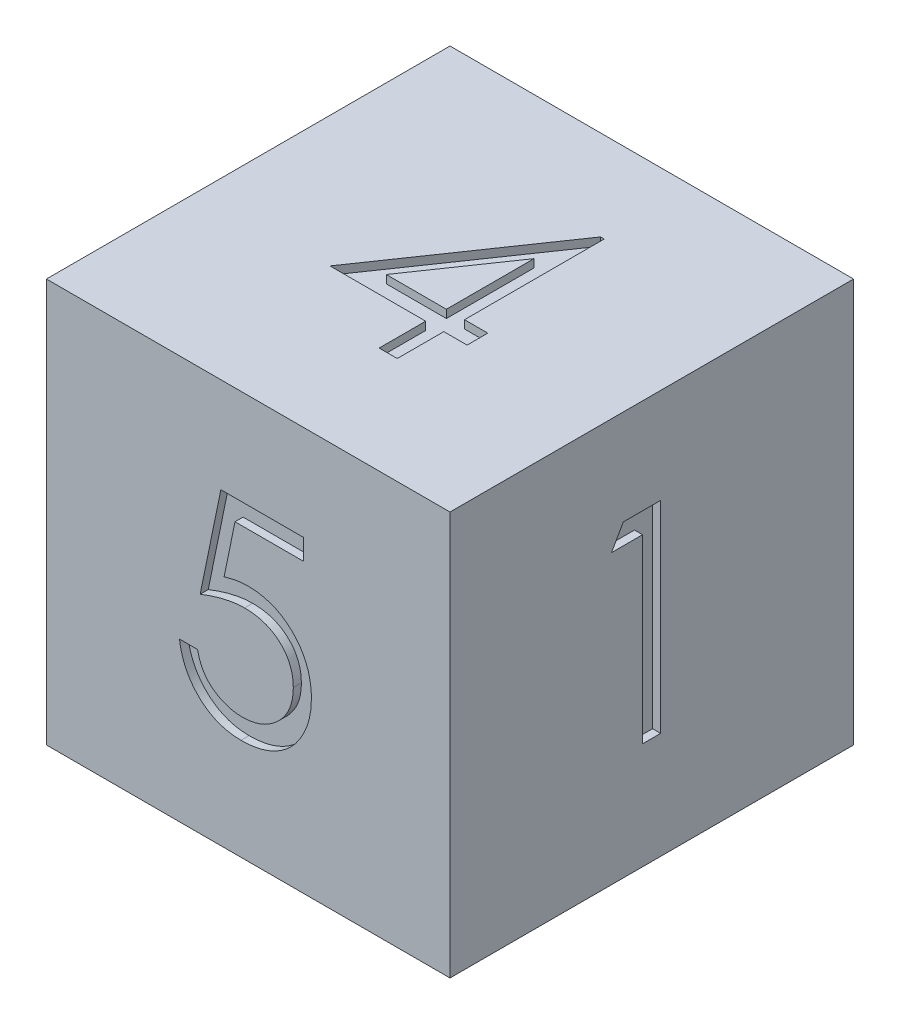
from build123d import *

# Parameters (mm, degrees)
BOSS_EXTRUDE1_DEPTH      = 25
BOSS_EXTRUDE1_DEPTH_BACK = 25
SKETCH1_W                = 50
SKETCH1_H                = 50
CUT_EXTRUDE1_DEPTH       = 1
CUT_EXTRUDE2_DEPTH       = 1
CUT_EXTRUDE3_DEPTH       = 1
CUT_EXTRUDE4_DEPTH       = 1
CUT_EXTRUDE5_DEPTH       = 1
CUT_EXTRUDE6_DEPTH       = 1


with BuildPart() as part:
    # Sketch1 → Boss-Extrude1 (new, two sides: drawn at the far end of the back side and taken through both)
    with BuildSketch(Plane.XY.offset(-BOSS_EXTRUDE1_DEPTH_BACK)):
        Rectangle(SKETCH1_W, SKETCH1_H)
    extrude(amount=BOSS_EXTRUDE1_DEPTH + BOSS_EXTRUDE1_DEPTH_BACK)

    # Sketch2 → Cut-Extrude1 (cut)
    with BuildSketch(Plane(origin=(25, 0, 0), x_dir=(0, 0, -1), z_dir=(1, 0, 0))):
        Polygon((-3.524959936, 13.2), (1.097435897, 13.2), (1.097435897, -11.8), (-1.146153846, -11.8), (-1.146153846, 10.635897436), (-4.992307692, 10.635897436), align=None)
    extrude(amount=-CUT_EXTRUDE1_DEPTH, mode=Mode.SUBTRACT)

    # Sketch3 → Cut-Extrude2 (cut)
    with BuildSketch(Plane.ZY.offset(25)):
        with BuildLine():
            Line((2.7, 13.841025641), (4.427764423, 12.483854167))
            Line((4.427764423, 12.483854167), (-2.177804487, 2.382692308))
            add(Edge.make_bspline(
                [(-2.177804487, 2.382692308), (-1.738016794, 2.452791312), (-0.880161175, 2.589527347), (-0.011833328, 2.6120841), (0.411338141, 2.623076923)],
                knots=[0, 0, 0, 0, 1.025318673, 2, 2, 2, 2], degree=3))
            add(Edge.make_bspline(
                [(0.411338141, 2.623076923), (0.665427401, 2.616247554), (1.165594547, 2.602804144), (1.899928848, 2.499348067), (2.605564105, 2.336311554), (3.279575621, 2.098652583), (3.924382634, 1.795064337), (4.543685464, 1.431215264), (5.125842679, 0.988317547), (5.678351102, 0.493567863), (6.179973226, -0.054410598), (6.624087908, -0.635848717), (6.997136421, -1.250140725), (7.299807289, -1.896975481), (7.534842137, -2.575355907), (7.706182458, -3.284414046), (7.807465264, -4.024638842), (7.821218769, -4.52805438), (7.828205128, -4.783774038)],
                knots=[0, 0, 0, 0, 1.04369286, 2.054478336, 3.041073146, 4.015093852, 4.984733326, 5.965804835, 6.960378782, 7.985147595, 9.009457201, 10.008161701, 10.986880575, 11.956520048, 12.937015923, 13.931873656, 14.949455224, 16, 16, 16, 16], degree=3))
            add(Edge.make_bspline(
                [(7.828205128, -4.783774038), (7.818040093, -5.133629067), (7.79803771, -5.822060966), (7.598724882, -6.824751726), (7.289013133, -7.77998398), (6.846316502, -8.672506633), (6.296442338, -9.501096415), (5.625888104, -10.235278311), (4.858434616, -10.890064292), (3.990671772, -11.437611572), (3.056793457, -11.884776222), (2.075707761, -12.205956523), (1.05694243, -12.40369559), (0.365480944, -12.428485609), (0.015705128, -12.441025641)],
                knots=[0, 0, 0, 0, 1.031375318, 2.029502543, 3.004789286, 3.987476834, 4.960371455, 5.9300674, 6.912260825, 7.929083631, 8.949397511, 9.960523116, 10.96833055, 12, 12, 12, 12], degree=3))
            add(Edge.make_bspline(
                [(0.015705128, -12.441025641), (-0.320699876, -12.430109886), (-0.987059291, -12.408487686), (-1.967293535, -12.215873844), (-2.909172231, -11.903680252), (-3.80609638, -11.473578263), (-4.636957901, -10.93030767), (-5.380283875, -10.276291391), (-6.032367979, -9.525509497), (-6.575043843, -8.678078446), (-7.005463357, -7.767435892), (-7.328248537, -6.817884775), (-7.516793131, -5.832884905), (-7.543139966, -5.165162483), (-7.556410256, -4.828846154)],
                knots=[0, 0, 0, 0, 1.012016664, 2.004627821, 2.994792927, 3.992885782, 4.990978636, 5.973936114, 6.964471063, 7.975201453, 8.993600317, 9.990122807, 10.98767138, 12, 12, 12, 12], degree=3))
            add(Edge.make_bspline(
                [(-7.556410256, -4.828846154), (-7.547971364, -4.571384845), (-7.530740757, -4.045698045), (-7.410430826, -3.249526417), (-7.217110863, -2.434875833), (-7.000609103, -1.74377445), (-6.771854746, -1.177620722), (-6.581479463, -0.721167218), (-6.344522348, -0.251445266), (-6.09185534, 0.247652134), (-5.800734848, 0.763262367), (-5.484194495, 1.304002863), (-5.133482703, 1.861273775), (-4.887624397, 2.239446599), (-4.761939103, 2.432772436)],
                knots=[0, 0, 0, 0, 1.173818275, 2.396712641, 3.66331629, 4.989737886, 5.693666774, 6.447286557, 7.243889047, 8.091586357, 8.998013824, 9.943181721, 10.948533338, 12, 12, 12, 12], degree=3))
            Line((-4.761939103, 2.432772436), (2.7, 13.841025641))
        make_face()
        with BuildLine():
            add(Edge.make_bspline(
                [(-0.059415064, 0.058974359), (-0.24985967, 0.053416904), (-0.621853309, 0.04256158), (-1.167620557, -0.020475933), (-1.684143781, -0.139183545), (-2.178266165, -0.29037163), (-2.640749757, -0.498250628), (-3.074955756, -0.750763478), (-3.482563269, -1.048057607), (-3.859302924, -1.385921258), (-4.200871948, -1.75583578), (-4.495022882, -2.152046652), (-4.748754312, -2.565005246), (-4.955053018, -2.998161976), (-5.115696416, -3.451351259), (-5.231898208, -3.922488754), (-5.29656786, -4.414733798), (-5.307326656, -4.748537389), (-5.312820513, -4.918990385)],
                knots=[0, 0, 0, 0, 1.129588631, 2.206414736, 3.251139165, 4.268635594, 5.265702196, 6.250456724, 7.242448911, 8.251968645, 9.246821453, 10.222880186, 11.173611482, 12.116736599, 13.062300278, 14.020270554, 14.989073742, 16, 16, 16, 16], degree=3))
            add(Edge.make_bspline(
                [(-5.312820513, -4.918990385), (-5.308346502, -5.087918812), (-5.299573634, -5.419162311), (-5.219914206, -5.907299307), (-5.098235046, -6.377048653), (-4.917232219, -6.825988645), (-4.701325875, -7.260962345), (-4.416287845, -7.666214384), (-4.10045366, -8.066357742), (-3.722925564, -8.430653966), (-3.317758686, -8.769629853), (-2.884892954, -9.065917378), (-2.433750383, -9.319390045), (-1.958240226, -9.518040743), (-1.465108912, -9.681071363), (-0.950247811, -9.795796215), (-0.413298843, -9.860657115), (-0.049570714, -9.871429926), (0.135897436, -9.876923077)],
                knots=[0, 0, 0, 0, 0.989467248, 1.94019797, 2.891935182, 3.827694429, 4.772920941, 5.730924762, 6.725747692, 7.756678648, 8.79901574, 9.819492441, 10.826891316, 11.826466727, 12.835195252, 13.867842842, 14.912794438, 16, 16, 16, 16], degree=3))
            add(Edge.make_bspline(
                [(0.135897436, -9.876923077), (0.321365282, -9.871429496), (0.685092815, -9.860655839), (1.222046103, -9.795801062), (1.736891236, -9.681053577), (2.230080583, -9.518105218), (2.705376519, -9.319150864), (3.15612453, -9.067494294), (3.584896627, -8.767807739), (3.99032948, -8.431233251), (4.366286183, -8.064284309), (4.689695318, -7.669786291), (4.966004127, -7.257687039), (5.190534034, -6.827702111), (5.369543258, -6.3767772), (5.491839452, -5.907372029), (5.571334373, -5.419143272), (5.580129846, -5.087912382), (5.584615385, -4.918990385)],
                knots=[0, 0, 0, 0, 1.087397944, 2.132534446, 3.165364764, 4.174271784, 5.174024072, 6.181601208, 7.194203697, 8.236725232, 9.267838612, 10.269026844, 11.221737037, 12.171628256, 13.107553087, 14.05945871, 15.010357665, 16, 16, 16, 16], degree=3))
            add(Edge.make_bspline(
                [(5.584615385, -4.918990385), (5.58068472, -4.748315021), (5.572970105, -4.413334789), (5.485713329, -3.922708944), (5.364696373, -3.448957471), (5.181960439, -2.995057835), (4.944556548, -2.562801212), (4.655389355, -2.150004063), (4.320870996, -1.753501582), (3.934459999, -1.385195808), (3.513815471, -1.048430965), (3.066561289, -0.75114842), (2.598647192, -0.500255729), (2.110547603, -0.290919284), (1.596669869, -0.139851612), (1.065310304, -0.020899876), (0.509672856, 0.042400251), (0.132697083, 0.053379288), (-0.059415064, 0.058974359)],
                knots=[0, 0, 0, 0, 0.978206639, 1.919901502, 2.851605144, 3.780102724, 4.718870031, 5.675451981, 6.667674623, 7.690630536, 8.733308323, 9.756129687, 10.767539656, 11.776269907, 12.797430371, 13.836405707, 14.897401972, 16, 16, 16, 16], degree=3))
        make_face(mode=Mode.SUBTRACT)
    extrude(amount=-CUT_EXTRUDE2_DEPTH, mode=Mode.SUBTRACT)

    # Sketch4 → Cut-Extrude3 (cut)
    with BuildSketch(Plane.XY.offset(25)):
        with BuildLine():
            Line((6.866666667, 13.2), (6.866666667, 10.635897436))
            Line((6.866666667, 10.635897436), (-1.636939103, 10.635897436))
            Line((-1.636939103, 10.635897436), (-2.984094551, 4.060376603))
            add(Edge.make_bspline(
                [(-2.984094551, 4.060376603), (-2.719409734, 4.133449973), (-2.206624764, 4.27501807), (-1.449768614, 4.432202144), (-0.731252875, 4.526955316), (-0.265000229, 4.539893248), (-0.039383013, 4.546153846)],
                knots=[0, 0, 0, 0, 1.100273476, 2.13160584, 3.095893838, 4, 4, 4, 4], degree=3))
            add(Edge.make_bspline(
                [(-0.039383013, 4.546153846), (0.239786557, 4.540111448), (0.78870368, 4.528230585), (1.591839016, 4.414145946), (2.358502539, 4.234575127), (3.087090897, 3.983714257), (3.778951973, 3.662930449), (4.42772027, 3.262216589), (5.043133934, 2.794121367), (5.614152462, 2.25594271), (6.132183235, 1.663645447), (6.587654589, 1.026803511), (6.974530234, 0.351605925), (7.285678484, -0.368398424), (7.534138014, -1.125249519), (7.699509406, -1.926910823), (7.809628756, -2.765825966), (7.821931515, -3.339430038), (7.828205128, -3.63193109)],
                knots=[0, 0, 0, 0, 1.052922333, 2.070308379, 3.05430497, 4.020497103, 4.973039431, 5.925935799, 6.892292201, 7.88610001, 8.88166317, 9.857072816, 10.836096531, 11.812156883, 12.81219415, 13.836441305, 14.89672472, 16, 16, 16, 16], degree=3))
            add(Edge.make_bspline(
                [(7.828205128, -3.63193109), (7.823454591, -3.835661235), (7.814017715, -4.240368289), (7.766027803, -4.841398294), (7.673629831, -5.429704245), (7.549574659, -6.005364186), (7.388557388, -6.567288273), (7.193635574, -7.117084901), (6.95509252, -7.651332092), (6.69343984, -8.175084914), (6.39882214, -8.676502823), (6.071832802, -9.145424155), (5.726365007, -9.588883308), (5.354640825, -10.002124259), (4.953205146, -10.382431529), (4.526919668, -10.732062111), (4.079185961, -11.056928756), (3.603077087, -11.343844436), (3.109202209, -11.607865552), (2.590429229, -11.824462247), (2.058567083, -12.018108876), (1.505960829, -12.172462645), (0.933862167, -12.293409463), (0.341328057, -12.37555661), (-0.268533872, -12.435388306), (-0.681926819, -12.439133713), (-0.890745192, -12.441025641)],
                knots=[0, 0, 0, 0, 1.056347294, 2.098418968, 3.122841568, 4.141288669, 5.149314143, 6.15115421, 7.162517403, 8.180376062, 9.185164535, 10.17417709, 11.141909838, 12.097768115, 13.052685741, 14.0056014, 14.954263652, 15.917497458, 16.885230207, 17.854509472, 18.828990115, 19.81800267, 20.826176721, 21.857883937, 22.917946725, 24, 24, 24, 24], degree=3))
            add(Edge.make_bspline(
                [(-0.890745192, -12.441025641), (-1.139846483, -12.436091084), (-1.629923845, -12.426382926), (-2.347927896, -12.324822317), (-3.038746508, -12.179365771), (-3.696818659, -11.960535272), (-4.328041971, -11.68634031), (-4.923918527, -11.339796228), (-5.49967407, -10.947088344), (-6.031902904, -10.483657252), (-6.525875143, -9.977116666), (-6.968064492, -9.427419229), (-7.361875754, -8.8436375), (-7.701002519, -8.222936399), (-7.990274099, -7.566946892), (-8.217524016, -6.873211172), (-8.400940837, -6.145354001), (-8.478536697, -5.644257498), (-8.517948718, -5.38974359)],
                knots=[0, 0, 0, 0, 1.0467383, 2.05933395, 3.04377827, 4.011590433, 4.970194871, 5.932262533, 6.905835911, 7.896367577, 8.894135286, 9.877477877, 10.858688626, 11.851381753, 12.8477658, 13.868841284, 14.917554742, 16, 16, 16, 16], degree=3))
            Line((-8.517948718, -5.38974359), (-6.274358974, -5.38974359))
            add(Edge.make_bspline(
                [(-6.274358974, -5.38974359), (-6.219154993, -5.628146822), (-6.113049876, -6.086371071), (-5.88015167, -6.730166366), (-5.595395417, -7.303875106), (-5.256792928, -7.815086415), (-4.852864139, -8.260864967), (-4.391939647, -8.658129696), (-3.875170195, -9.016523476), (-3.300932841, -9.315257528), (-2.695125132, -9.570034338), (-2.061073632, -9.739689302), (-1.416042586, -9.858981394), (-0.979768513, -9.870922542), (-0.760536859, -9.876923077)],
                knots=[0, 0, 0, 0, 1.136247022, 2.183929868, 3.172523383, 4.106158343, 5.02341133, 5.958108904, 6.928429099, 7.938127109, 8.96079061, 9.975095812, 10.982467395, 12, 12, 12, 12], degree=3))
            add(Edge.make_bspline(
                [(-0.760536859, -9.876923077), (-0.54654797, -9.871060378), (-0.125202098, -9.859516675), (0.494879236, -9.770666588), (1.093542623, -9.633826793), (1.664880886, -9.429042115), (2.218891883, -9.180151269), (2.741561672, -8.86075787), (3.248010794, -8.49318631), (3.722497462, -8.072067524), (4.157064957, -7.607998277), (4.541037251, -7.111731181), (4.860872346, -6.582325134), (5.130401695, -6.028945471), (5.335068116, -5.445527205), (5.481075124, -4.834804525), (5.566811259, -4.195268952), (5.578605401, -3.759059597), (5.584615385, -3.536778846)],
                knots=[0, 0, 0, 0, 1.027316725, 2.022795036, 3.002884548, 3.971462791, 4.93288096, 5.914575861, 6.907176829, 7.935150275, 8.956128384, 9.956726525, 10.942570165, 11.921478529, 12.907843606, 13.90538589, 14.932640048, 16, 16, 16, 16], degree=3))
            add(Edge.make_bspline(
                [(5.584615385, -3.536778846), (5.57991196, -3.336237763), (5.570705675, -2.943707127), (5.495487316, -2.369427081), (5.364651799, -1.826048207), (5.183052657, -1.310946536), (4.952484744, -0.823636234), (4.670725371, -0.363614375), (4.332486814, 0.063055862), (3.946116181, 0.456574102), (3.52284446, 0.81975178), (3.055389156, 1.129352397), (2.553532536, 1.389808952), (2.023321111, 1.614580369), (1.452143264, 1.776014264), (0.851310176, 1.897213446), (0.21433369, 1.96732318), (-0.221171225, 1.977050954), (-0.445032051, 1.982051282)],
                knots=[0, 0, 0, 0, 1.045622112, 2.046656509, 3.013763289, 3.955457236, 4.890082067, 5.820317437, 6.762574623, 7.722996705, 8.69280354, 9.665887285, 10.63943826, 11.638615906, 12.663482002, 13.728887084, 14.832589034, 16, 16, 16, 16], degree=3))
            add(Edge.make_bspline(
                [(-0.445032051, 1.982051282), (-0.638810114, 1.977904202), (-1.038912652, 1.969341535), (-1.652647129, 1.906295129), (-2.297588007, 1.804585883), (-2.971262976, 1.664684115), (-3.675695176, 1.481604996), (-4.409398039, 1.262215706), (-5.173914229, 0.999915715), (-5.689040831, 0.801828474), (-5.953846154, 0.7)],
                knots=[0, 0, 0, 0, 0.817624296, 1.688186739, 2.600797293, 3.572016777, 4.590301741, 5.671205678, 6.80286297, 8, 8, 8, 8], degree=3))
            Line((-5.953846154, 0.7), (-3.38974359, 13.2))
            Line((-3.38974359, 13.2), (6.866666667, 13.2))
        make_face()
    extrude(amount=-CUT_EXTRUDE3_DEPTH, mode=Mode.SUBTRACT)

    # Sketch5 → Cut-Extrude4 (cut)
    with BuildSketch(Plane(origin=(0, 0, -25), x_dir=(-1, 0, 0), z_dir=(0, 0, -1))):
        with BuildLine():
            Line((-5.633333333, 5.507692308), (-7.876923077, 5.507692308))
            add(Edge.make_bspline(
                [(-7.876923077, 5.507692308), (-7.862300555, 5.805341506), (-7.833582312, 6.38991661), (-7.699094532, 7.242230227), (-7.506659695, 8.056907361), (-7.23457788, 8.827406747), (-6.896675896, 9.560541084), (-6.491461415, 10.253398339), (-6.01150534, 10.903335401), (-5.467171525, 11.504327139), (-4.875966961, 12.05566693), (-4.238067393, 12.531775808), (-3.56774577, 12.934044889), (-2.867035777, 13.270339473), (-2.128031751, 13.522766944), (-1.35743991, 13.71006437), (-0.55187465, 13.822752553), (-0.003017349, 13.834865308), (0.276121795, 13.841025641)],
                knots=[0, 0, 0, 0, 1.10065271, 2.161652631, 3.183658789, 4.190468796, 5.17591951, 6.163126047, 7.15150782, 8.156236427, 9.156009102, 10.134482811, 11.092018607, 12.041330605, 13.001268258, 13.972401359, 14.968799086, 16, 16, 16, 16], degree=3))
            add(Edge.make_bspline(
                [(0.276121795, 13.841025641), (0.550250895, 13.834608095), (1.088904786, 13.821997846), (1.875062032, 13.71370478), (2.623471278, 13.544093411), (3.33266961, 13.306126152), (3.996998643, 12.986237385), (4.621448961, 12.601969252), (5.213454753, 12.157541885), (5.74636035, 11.63430036), (6.235703773, 11.075711899), (6.657862738, 10.479369731), (7.019385335, 9.863446261), (7.320725905, 9.223244822), (7.542555469, 8.552737476), (7.710971241, 7.861686027), (7.806167053, 7.142937377), (7.820777221, 6.65646198), (7.828205128, 6.409134615)],
                knots=[0, 0, 0, 0, 1.111607364, 2.184268762, 3.212621178, 4.221274766, 5.211760367, 6.196651075, 7.1921475, 8.207485113, 9.220403448, 10.201281604, 11.166441695, 12.114753415, 13.065576456, 14.026450734, 14.996634279, 16, 16, 16, 16], degree=3))
            add(Edge.make_bspline(
                [(7.828205128, 6.409134615), (7.816110394, 6.060935797), (7.79213317, 5.370648556), (7.58703048, 4.35625668), (7.266698258, 3.373446543), (6.881002852, 2.582465814), (6.491913966, 1.945083716), (6.141288911, 1.420307252), (5.730825975, 0.855268192), (5.25455099, 0.25185864), (4.722316189, -0.394647825), (4.129300736, -1.08386065), (3.471275865, -1.808659005), (3.009429431, -2.303699015), (2.770112179, -2.560216346)],
                knots=[0, 0, 0, 0, 1.184426356, 2.348067706, 3.509069118, 4.696110526, 5.333549288, 6.050745305, 6.844228056, 7.710549037, 8.667450064, 9.695053472, 10.805634456, 12, 12, 12, 12], degree=3))
            Line((2.770112179, -2.560216346), (-3.484895833, -9.235897436))
            Line((-3.484895833, -9.235897436), (8.148717949, -9.235897436))
            Line((8.148717949, -9.235897436), (8.148717949, -11.8))
            Line((8.148717949, -11.8), (-8.838461538, -11.8))
            Line((-8.838461538, -11.8), (0.857051282, -1.453445513))
            add(Edge.make_bspline(
                [(0.857051282, -1.453445513), (1.093107616, -1.207029037), (1.546523524, -0.733713419), (2.187827644, -0.042692275), (2.763820418, 0.598375873), (3.278230366, 1.188279791), (3.719898262, 1.735648132), (4.111842776, 2.222753158), (4.425882711, 2.670999231), (4.766706966, 3.190575045), (5.096806833, 3.824948739), (5.380466519, 4.600189377), (5.553429723, 5.398241181), (5.574178548, 5.937541446), (5.584615385, 6.208814103)],
                knots=[0, 0, 0, 0, 1.329631726, 2.553950428, 3.673215718, 4.687767853, 5.603093632, 6.413772471, 7.123043292, 7.734684054, 8.834405432, 9.900288307, 10.943827018, 12, 12, 12, 12], degree=3))
            add(Edge.make_bspline(
                [(5.584615385, 6.208814103), (5.580074368, 6.37939552), (5.571124897, 6.715578737), (5.492141343, 7.208477015), (5.372780585, 7.683939971), (5.201743028, 8.143430108), (4.975980599, 8.582327622), (4.701170742, 9.001166767), (4.384098861, 9.406087947), (4.01730408, 9.785754362), (3.614364653, 10.133477258), (3.188691441, 10.441506439), (2.738333554, 10.698928659), (2.265189824, 10.909953639), (1.770579328, 11.075492076), (1.253545434, 11.190196215), (0.715516747, 11.262213958), (0.348134635, 11.271958043), (0.1609375, 11.276923077)],
                knots=[0, 0, 0, 0, 0.991446411, 1.95395049, 2.89581595, 3.838931463, 4.798493298, 5.75982156, 6.748411868, 7.785213223, 8.824556874, 9.840280684, 10.836137867, 11.835679398, 12.848801643, 13.863922112, 14.911575587, 16, 16, 16, 16], degree=3))
            add(Edge.make_bspline(
                [(0.1609375, 11.276923077), (-0.034568448, 11.271815704), (-0.41850985, 11.261785666), (-0.982217228, 11.19162378), (-1.519972782, 11.070582063), (-2.033129231, 10.905034389), (-2.522554844, 10.694616183), (-2.985869445, 10.432532292), (-3.422032939, 10.119793056), (-3.831865249, 9.765217653), (-4.209465099, 9.370449073), (-4.541228498, 8.930377908), (-4.831114314, 8.453039227), (-5.08403741, 7.939721009), (-5.289435196, 7.385765437), (-5.446386271, 6.793138974), (-5.570578033, 6.164414821), (-5.612067466, 5.730235644), (-5.633333333, 5.507692308)],
                knots=[0, 0, 0, 0, 1.031018746, 2.02475058, 2.990194455, 3.934040569, 4.864654155, 5.795059489, 6.735614925, 7.690564532, 8.649604399, 9.611025574, 10.590972636, 11.591080095, 12.624614302, 13.701020113, 14.821632451, 16, 16, 16, 16], degree=3))
        make_face()
    extrude(amount=-CUT_EXTRUDE4_DEPTH, mode=Mode.SUBTRACT)

    # Sketch6 → Cut-Extrude5 (cut)
    with BuildSketch(Plane(origin=(0, 25, 0), x_dir=(1, 0, 0), z_dir=(0, 1, 0))):
        Polygon((4.808373397, 13.841025641), (5.264102564, 13.841025641), (5.264102564, -3.466666667), (8.148717949, -3.466666667), (8.148717949, -6.030769231), (5.264102564, -6.030769231), (5.264102564, -11.8), (3.020512821, -11.8), (3.020512821, -6.030769231), (-8.838461538, -6.030769231), align=None)
        Polygon((3.020512821, -3.466666667), (3.020512821, 7.390705128), (-4.431410256, -3.466666667), align=None, mode=Mode.SUBTRACT)
    extrude(amount=-CUT_EXTRUDE5_DEPTH, mode=Mode.SUBTRACT)

    # Sketch7 → Cut-Extrude6 (cut)
    with BuildSketch(Plane.XZ.offset(25)):
        with BuildLine():
            Line((-5.633333333, 7.430769231), (-7.876923077, 7.430769231))
            add(Edge.make_bspline(
                [(-7.876923077, 7.430769231), (-7.816140572, 7.682429831), (-7.697315747, 8.174405719), (-7.449475936, 8.877314725), (-7.179481256, 9.542482735), (-6.855273366, 10.15745469), (-6.501639408, 10.73458971), (-6.096477111, 11.260797741), (-5.658479093, 11.749461781), (-5.174015169, 12.183127763), (-4.6659533, 12.575825829), (-4.127134588, 12.910647667), (-3.568399633, 13.19867733), (-2.985877255, 13.435964701), (-2.377833171, 13.614718441), (-1.749764433, 13.74440991), (-1.100025147, 13.828632154), (-0.658970928, 13.836851891), (-0.435016026, 13.841025641)],
                knots=[0, 0, 0, 0, 1.162005537, 2.271625781, 3.343758855, 4.383309926, 5.390229558, 6.379919256, 7.361854164, 8.333198761, 9.295911338, 10.242430842, 11.177959212, 12.116337295, 13.062827104, 14.020064771, 14.994644689, 16, 16, 16, 16], degree=3))
            add(Edge.make_bspline(
                [(-0.435016026, 13.841025641), (-0.108710725, 13.831173996), (0.53678221, 13.8116856), (1.485089688, 13.63372534), (2.399566968, 13.352117251), (3.270204452, 12.9630192), (4.078907542, 12.483109821), (4.798451733, 11.911933129), (5.419083953, 11.260509546), (5.939758079, 10.54099123), (6.347436644, 9.772023306), (6.648053597, 8.980593612), (6.831065605, 8.16857953), (6.854783867, 7.620313251), (6.866666667, 7.345633013)],
                knots=[0, 0, 0, 0, 1.083050992, 2.142477498, 3.193116406, 4.255571735, 5.30263384, 6.308962982, 7.297363603, 8.282367274, 9.249857812, 10.179914175, 11.08814088, 12, 12, 12, 12], degree=3))
            add(Edge.make_bspline(
                [(6.866666667, 7.345633013), (6.858355302, 7.081298765), (6.842091251, 6.564037662), (6.703993354, 5.808884111), (6.471591477, 5.097158394), (6.149664601, 4.425864379), (5.732939242, 3.79925838), (5.228134264, 3.215930589), (4.63168668, 2.673293745), (4.179694266, 2.362440366), (3.946995192, 2.202403846)],
                knots=[0, 0, 0, 0, 1.024540389, 2.004866551, 2.965041327, 3.920577974, 4.882998113, 5.874504559, 6.905732034, 8, 8, 8, 8], degree=3))
            add(Edge.make_bspline(
                [(3.946995192, 2.202403846), (4.212936296, 2.073988335), (4.739842541, 1.819560066), (5.458060609, 1.32059037), (6.110045433, 0.744473603), (6.473643426, 0.294883225), (6.656330128, 0.068990385)],
                knots=[0, 0, 0, 0, 1.015518401, 2.012035669, 3.001164323, 4, 4, 4, 4], degree=3))
            add(Edge.make_bspline(
                [(6.656330128, 0.068990385), (6.776625431, -0.095707841), (7.015246117, -0.422407245), (7.309785644, -0.94766743), (7.576993603, -1.478749496), (7.785209455, -2.029888111), (7.946451361, -2.594695352), (8.061708734, -3.174141038), (8.133309741, -3.768698341), (8.143563684, -4.170930342), (8.148717949, -4.373116987)],
                knots=[0, 0, 0, 0, 1.025084078, 2.033381695, 3.024893161, 4.013698104, 4.991890475, 5.976764909, 6.982997093, 8, 8, 8, 8], degree=3))
            add(Edge.make_bspline(
                [(8.148717949, -4.373116987), (8.135899995, -4.723186424), (8.110324409, -5.421677866), (7.881723878, -6.453640163), (7.527343588, -7.462393751), (7.024079759, -8.427214031), (6.410740411, -9.329931039), (5.681045238, -10.13761896), (4.843285178, -10.831894705), (3.908959115, -11.411967763), (2.896693911, -11.875667207), (1.814011111, -12.197506085), (0.676510726, -12.407120368), (-0.1035414, -12.429598003), (-0.500120192, -12.441025641)],
                knots=[0, 0, 0, 0, 0.955779014, 1.907060117, 2.875433937, 3.871313158, 4.872415639, 5.851225146, 6.836215519, 7.83643374, 8.849228613, 9.86973379, 10.916971861, 12, 12, 12, 12], degree=3))
            add(Edge.make_bspline(
                [(-0.500120192, -12.441025641), (-0.767400909, -12.434824118), (-1.293320231, -12.422621588), (-2.066488076, -12.339203008), (-2.804500214, -12.186845828), (-3.508354485, -11.981822218), (-4.178676173, -11.721881203), (-4.813419782, -11.398176217), (-5.41649045, -11.017379774), (-5.982197244, -10.574997004), (-6.510472727, -10.080130291), (-6.9872779, -9.523994506), (-7.420562136, -8.916870192), (-7.798723841, -8.251705505), (-8.138987788, -7.537096524), (-8.418851764, -6.763892965), (-8.665177254, -5.939007093), (-8.779701999, -5.364166092), (-8.838461538, -5.069230769)],
                knots=[0, 0, 0, 0, 1.048658725, 2.063410685, 3.046034179, 4.001477787, 4.936774919, 5.862367409, 6.792675028, 7.730719943, 8.675894397, 9.627829632, 10.600096036, 11.597688215, 12.626045268, 13.701542398, 14.82072376, 16, 16, 16, 16], degree=3))
            Line((-8.838461538, -5.069230769), (-6.594871795, -5.069230769))
            add(Edge.make_bspline(
                [(-6.594871795, -5.069230769), (-6.536419713, -5.261723721), (-6.422725337, -5.636139233), (-6.229194637, -6.174998559), (-6.008706979, -6.668984653), (-5.772174417, -7.121721239), (-5.523756946, -7.537666971), (-5.245793195, -7.905823178), (-4.95887073, -8.242360337), (-4.742589634, -8.431964708), (-4.636738782, -8.524759615)],
                knots=[0, 0, 0, 0, 1.198163088, 2.33053128, 3.407730985, 4.417276592, 5.372219308, 6.28897303, 7.162600585, 8, 8, 8, 8], degree=3))
            add(Edge.make_bspline(
                [(-4.636738782, -8.524759615), (-4.496763235, -8.632676286), (-4.217244215, -8.848176513), (-3.76175685, -9.123188145), (-3.282721949, -9.361481184), (-2.769759991, -9.543507582), (-2.233940202, -9.69763373), (-1.666601879, -9.798494581), (-1.072750328, -9.867695805), (-0.667266303, -9.873802458), (-0.46005609, -9.876923077)],
                knots=[0, 0, 0, 0, 0.946170439, 1.889420265, 2.845303464, 3.807233317, 4.801018734, 5.828864929, 6.890507805, 8, 8, 8, 8], degree=3))
            add(Edge.make_bspline(
                [(-0.46005609, -9.876923077), (-0.226102499, -9.872523754), (0.23137355, -9.863921257), (0.89890826, -9.784809065), (1.533961456, -9.669591826), (2.129482355, -9.491641949), (2.693271693, -9.271778724), (3.217426333, -8.995718686), (3.708827092, -8.671827817), (4.161179988, -8.303690969), (4.567933613, -7.90068029), (4.926072993, -7.479158354), (5.230534861, -7.040902429), (5.476131848, -6.583487279), (5.67006435, -6.108807073), (5.802087211, -5.61552972), (5.893883748, -5.107692105), (5.901359549, -4.762485184), (5.905128205, -4.588461538)],
                knots=[0, 0, 0, 0, 1.217147791, 2.380027433, 3.494444702, 4.572153297, 5.609568379, 6.639424714, 7.649109417, 8.668170816, 9.669597737, 10.625200337, 11.543417969, 12.441394052, 13.322311151, 14.205496177, 15.095365482, 16, 16, 16, 16], degree=3))
            add(Edge.make_bspline(
                [(5.905128205, -4.588461538), (5.89419748, -4.355523404), (5.872390419, -3.890806202), (5.705900566, -3.207109243), (5.432051536, -2.548370582), (5.048676455, -1.925829225), (4.581992679, -1.3488585), (4.036529059, -0.834062196), (3.407755999, -0.409275831), (2.829042649, -0.115785429), (2.316434388, 0.084479394), (1.877753071, 0.217871997), (1.386634475, 0.330826681), (0.849017697, 0.435914335), (0.260851866, 0.525352536), (-0.377222691, 0.599936934), (-1.065335274, 0.659615798), (-1.541700745, 0.686266478), (-1.787179487, 0.7)],
                knots=[0, 0, 0, 0, 1.07054697, 2.135767047, 3.216561865, 4.33974944, 5.486079747, 6.621378074, 7.775625952, 8.963672916, 9.598146892, 10.304877434, 11.070270905, 11.915000392, 12.823868403, 13.805723172, 14.86925407, 16, 16, 16, 16], degree=3))
            Line((-1.787179487, 0.7), (-1.787179487, 3.264102564))
            add(Edge.make_bspline(
                [(-1.787179487, 3.264102564), (-1.477885446, 3.269351162), (-0.872054399, 3.279631876), (0.01290492, 3.403974808), (0.859142864, 3.575979294), (1.647905307, 3.839444953), (2.366824688, 4.145447073), (2.990536131, 4.501534284), (3.510301469, 4.897353922), (3.923594837, 5.339015417), (4.234517899, 5.812694327), (4.461852166, 6.30638474), (4.596140211, 6.824413746), (4.614066403, 7.177947089), (4.623076923, 7.355649038)],
                knots=[0, 0, 0, 0, 1.321986639, 2.589447074, 3.816329219, 5.01088745, 6.139805852, 7.153945165, 8.075214402, 8.924034688, 9.728124013, 10.488707548, 11.240355623, 12, 12, 12, 12], degree=3))
            add(Edge.make_bspline(
                [(4.623076923, 7.355649038), (4.620116845, 7.486204361), (4.614227909, 7.745937983), (4.53996164, 8.125402759), (4.428361347, 8.493266659), (4.274934709, 8.847965304), (4.069576147, 9.187038688), (3.8238191, 9.513377609), (3.531189812, 9.825118888), (3.195865191, 10.115692599), (2.83578087, 10.392615722), (2.441139619, 10.627713129), (2.023840514, 10.828749287), (1.583421551, 10.994531444), (1.118453477, 11.119240646), (0.631120923, 11.20878237), (0.120494612, 11.264765618), (-0.227874903, 11.272825732), (-0.404967949, 11.276923077)],
                knots=[0, 0, 0, 0, 0.884392785, 1.759457502, 2.611959086, 3.489218968, 4.37281399, 5.2945488, 6.255912374, 7.266815255, 8.301784654, 9.332968512, 10.37626691, 11.440494194, 12.520033166, 13.637162961, 14.798855837, 16, 16, 16, 16], degree=3))
            add(Edge.make_bspline(
                [(-0.404967949, 11.276923077), (-0.68962272, 11.266984777), (-1.245619694, 11.247572965), (-2.047154815, 11.077551441), (-2.792292915, 10.806279416), (-3.361854819, 10.482472134), (-3.782444635, 10.162826178), (-4.082994193, 9.883666276), (-4.378140696, 9.573431821), (-4.648466959, 9.213014855), (-4.921852507, 8.826823496), (-5.170742232, 8.395225771), (-5.412597177, 7.929480097), (-5.558329674, 7.600225565), (-5.633333333, 7.430769231)],
                knots=[0, 0, 0, 0, 1.472543308, 2.876219568, 4.221790263, 5.565193594, 6.249813518, 6.953379497, 7.687249741, 8.463570142, 9.283606569, 10.136032583, 11.040678096, 12, 12, 12, 12], degree=3))
        make_face()
    extrude(amount=-CUT_EXTRUDE6_DEPTH, mode=Mode.SUBTRACT)


solid = part.part
